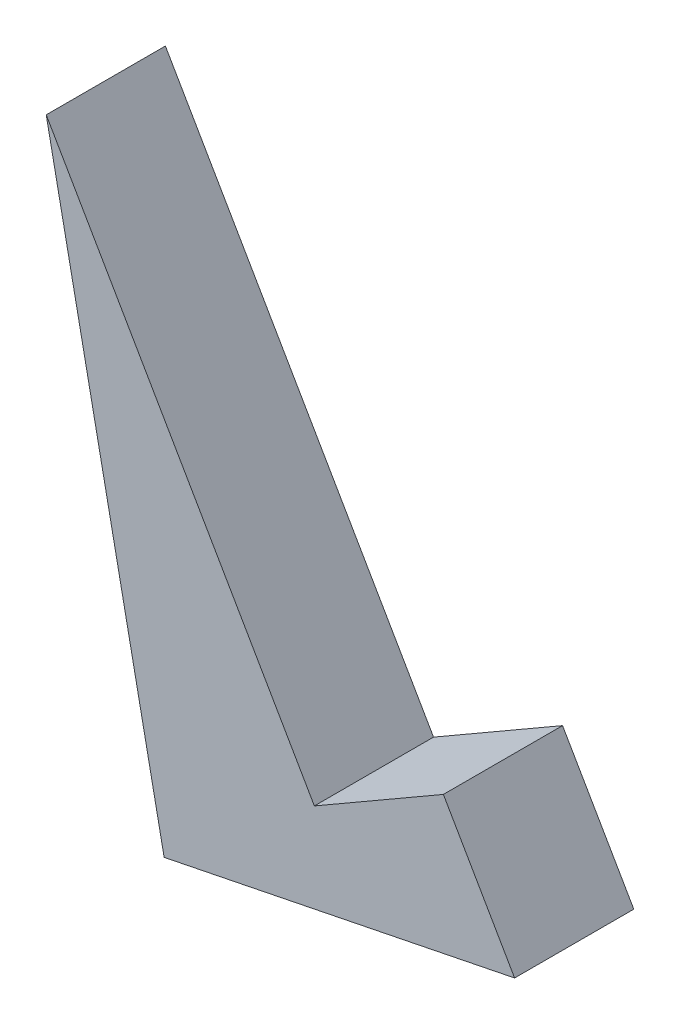
from build123d import *

# Parameters (mm, degrees)
BOSS_EXTRU_1_DEPTH = 10


with BuildPart() as part:
    # Model → Boss.-Extru.1 (new body)
    with BuildSketch(Plane.XY):
        Polygon((422.702011512, -113.846607074), (411.876691089, -120.096602094), (389.376709015, -81.125448575), (399.272386792, -130.136422461), (428.678971124, -124.199015795), align=None)
    extrude(amount=BOSS_EXTRU_1_DEPTH)


solid = part.part
